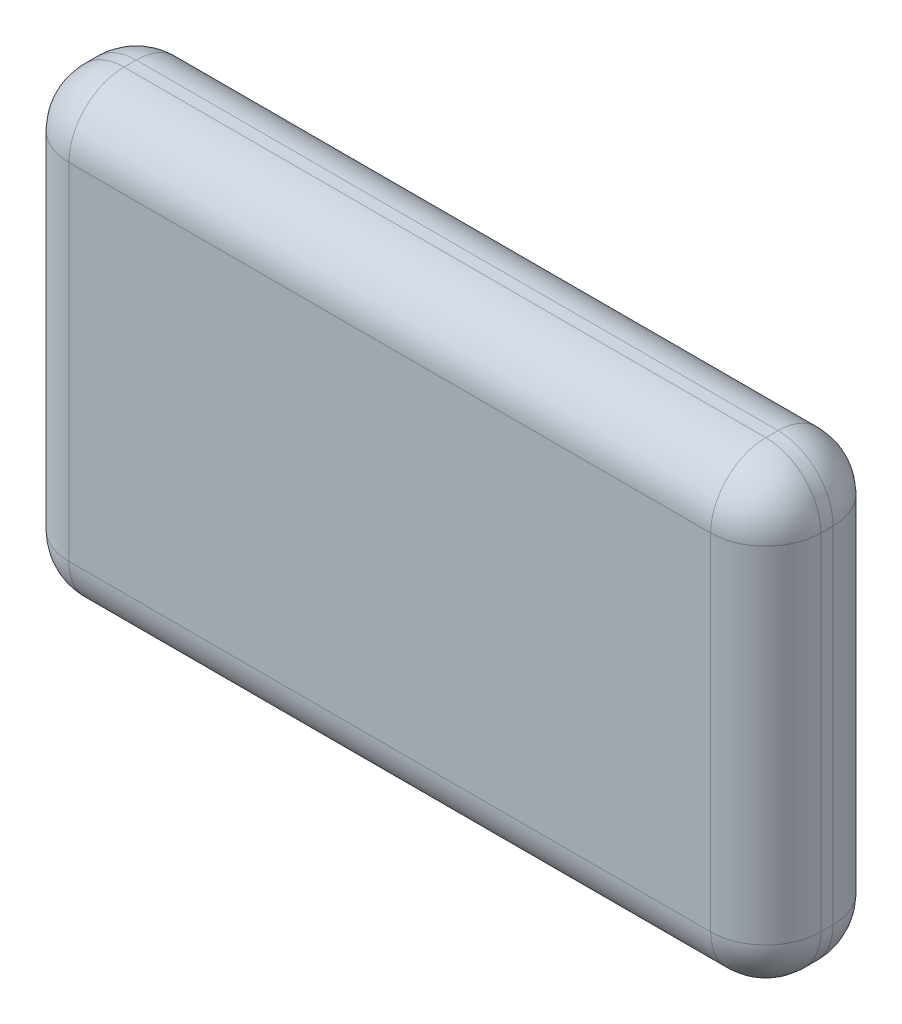
from build123d import *

# Parameters (mm, degrees)
SKETCH1_W           = 614.398858185
SKETCH1_H           = 372.242140157
BOSS_EXTRUDE1_DEPTH = 100
FILLET1_R           = 45


with BuildPart() as part:
    # Sketch1 → Boss-Extrude1 (new body)
    with BuildSketch(Plane.XY):
        with Locations((148.600222275, 171.014952726)):
            Rectangle(SKETCH1_W, SKETCH1_H)
    extrude(amount=BOSS_EXTRUDE1_DEPTH)

    # Fillet1
    fillet1_edges = [part.edges().sort_by_distance(p)[0] for p in [
        (455.799651367, 171.014952725, 100),
        (148.600222275, 357.136022804, 100),
        (-158.599206818, 171.014952725, 100),
        (148.600222275, 357.136022804, 0),
        (455.799651367, 171.014952725, 0),
        (148.600222275, -15.106117353, 0),
        (-158.599206818, 171.014952725, 0),
        (-158.599206818, 357.136022804, 50),
        (455.799651367, 357.136022804, 50),
        (455.799651367, -15.106117353, 50),
        (-158.599206818, -15.106117353, 50),
        (148.600222275, -15.106117353, 100),
    ]]
    fillet(fillet1_edges, radius=FILLET1_R)


solid = part.part
